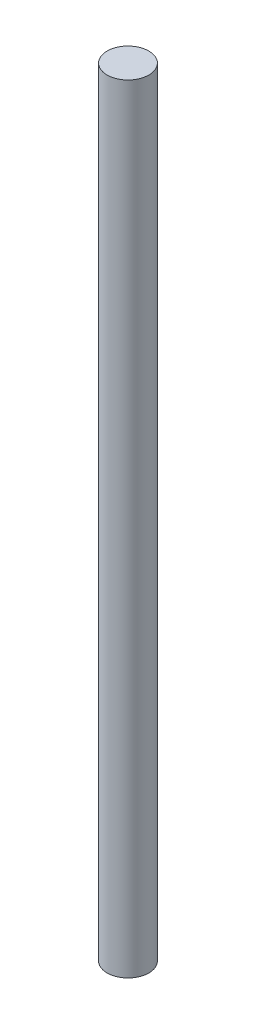
from build123d import *

# Parameters (mm, degrees)
SKETCH1_R           = 4.7625
BOSS_EXTRUDE1_DEPTH = 177.8


with BuildPart() as part:
    # Sketch1 → Boss-Extrude1 (new body)
    with BuildSketch(Plane(origin=(0, 0, 0), x_dir=(1, 0, 0), z_dir=(0, 1, 0))):
        with Locations(Location((0, 0, 0), (0, 0, 270))):
            Circle(SKETCH1_R)
    extrude(amount=BOSS_EXTRUDE1_DEPTH)


solid = part.part
